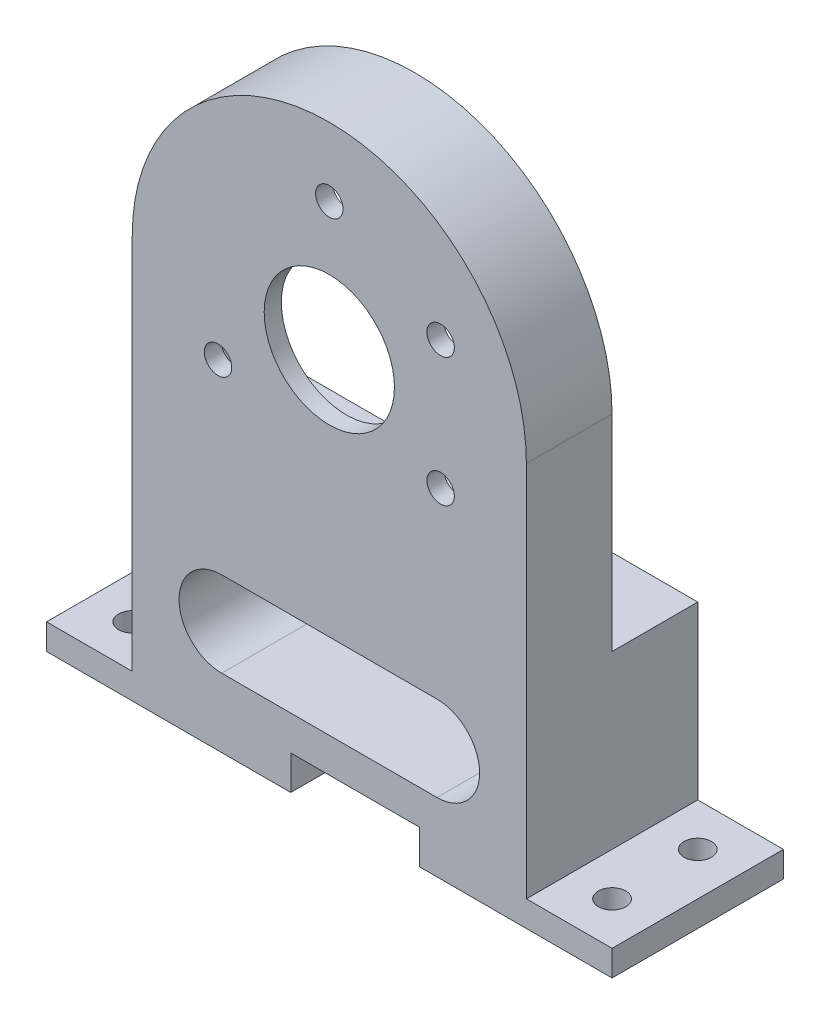
from build123d import *

# Parameters (mm, degrees)
EXTRUDE_1_DEPTH      = 20
CUT_EXTRUDE_1_DEPTH  = 10
SKETCH_3_R           = 21.1
CUT_EXTRUDE_2_DEPTH  = 8
SKETCH_7_R           = 1.6
CUT_EXTRUDE_6_DEPTH  = 3
SKETCH_8_R           = 7.6
CUT_EXTRUDE_7_DEPTH  = 3
SKETCH_12_W          = 46
SKETCH_12_H          = 20
EXTRUDE_4_DEPTH      = 20
SKETCH_14_W          = 10
SKETCH_14_H          = 20
SKETCH_14_R          = 1.6
EXTRUDE_5_DEPTH      = 3
SKETCH_16_W          = 15
SKETCH_16_H          = 20
CUT_EXTRUDE_10_DEPTH = 4
CUT_EXTRUDE_11_DEPTH = 61.811183182


with BuildPart() as part:
    # 草图1 → 凸台-拉伸1 (new body)
    with BuildSketch(Plane.XY):
        with BuildLine():
            Line((-23, 0), (-23, -27))
            Line((-23, -27), (23, -27))
            Line((23, -27), (23, 0))
            ThreePointArc((23, 0), (0, 23), (-23, 0))
        make_face()
    extrude(amount=EXTRUDE_1_DEPTH)

    # 草图2 → 切除-拉伸1 (cut)
    with BuildSketch(Plane(origin=(0, 0, 0), x_dir=(-1, 0, 0), z_dir=(0, 0, -1))):
        with BuildLine():
            Line((-23, -24), (23, -24))
            Line((23, -24), (23, 0))
            ThreePointArc((23, 0), (0, 23), (-23, 0))
            Line((-23, 0), (-23, -24))
        make_face()
    extrude(amount=-CUT_EXTRUDE_1_DEPTH, mode=Mode.SUBTRACT)

    # 草图3 → 切除-拉伸2 (cut)
    with BuildSketch(Plane(origin=(0, 0, 10), x_dir=(-1, 0, 0), z_dir=(0, 0, -1))):
        Circle(SKETCH_3_R)
    extrude(amount=-CUT_EXTRUDE_2_DEPTH, mode=Mode.SUBTRACT)

    # 草图7 → 切除-拉伸6 (cut)
    with BuildSketch(Plane.XY.offset(20)):
        with Locations((0, 15)):
            Circle(SKETCH_7_R)
        with Locations((12.990381057, 7.5)):
            Circle(SKETCH_7_R)
        with Locations((12.990381057, -7.5)):
            Circle(SKETCH_7_R)
        with Locations((-12.990381057, -7.5)):
            Circle(SKETCH_7_R)
    extrude(amount=-CUT_EXTRUDE_6_DEPTH, mode=Mode.SUBTRACT)

    # 草图8 → 切除-拉伸7 (cut)
    with BuildSketch(Plane(origin=(0, 0, 18), x_dir=(-1, 0, 0), z_dir=(0, 0, -1))):
        Circle(SKETCH_8_R)
    extrude(amount=-CUT_EXTRUDE_7_DEPTH, mode=Mode.SUBTRACT)

    # 草图12 → 凸台-拉伸4 (add)
    with BuildSketch(Plane.XZ.offset(27)):
        with Locations((0, 10)):
            Rectangle(SKETCH_12_W, SKETCH_12_H)
    extrude(amount=EXTRUDE_4_DEPTH)

    # 草图14 → 凸台-拉伸5 (add)
    # profile 1 of 2: a face of its own
    with BuildSketch(Plane.XZ.offset(47)):
        with Locations((28, 10)):
            Rectangle(SKETCH_14_W, SKETCH_14_H)
        with Locations(Location((28, 5, 0), (0, 0, 270))):
            Circle(SKETCH_14_R, mode=Mode.SUBTRACT)
        with Locations(Location((28, 15, 0), (0, 0, 270))):
            Circle(SKETCH_14_R, mode=Mode.SUBTRACT)
    # profile 2 of 2: a face of its own
    with BuildSketch(Plane.XZ.offset(47)):
        with Locations((-28, 10)):
            Rectangle(SKETCH_14_W, SKETCH_14_H)
        with Locations(Location((-28, 5, 0), (0, 0, 270))):
            Circle(SKETCH_14_R, mode=Mode.SUBTRACT)
        with Locations(Location((-28, 15, 0), (0, 0, 270))):
            Circle(SKETCH_14_R, mode=Mode.SUBTRACT)
    extrude(amount=-EXTRUDE_5_DEPTH)

    # 草图16 → 切除-拉伸10 (cut)
    with BuildSketch(Plane.XZ.offset(47)):
        with Locations((3, 10)):
            Rectangle(SKETCH_16_W, SKETCH_16_H)
    extrude(amount=-CUT_EXTRUDE_10_DEPTH, mode=Mode.SUBTRACT)

    # 草图17 → 切除-拉伸11 (cut, through all)
    with BuildSketch(Plane(origin=(0, 0, 0), x_dir=(-1, 0, 0), z_dir=(0, 0, -1))):
        with BuildLine():
            Line((-12.566151066, -29.028305096), (12.566151066, -29.028305096))
            ThreePointArc((12.566151066, -29.028305096), (17.53784597, -34), (12.566151066, -38.971694904))
            Line((12.566151066, -38.971694904), (-12.566151066, -38.971694904))
            ThreePointArc((-12.566151066, -38.971694904), (-17.53784597, -34), (-12.566151066, -29.028305096))
        make_face()
    extrude(amount=-CUT_EXTRUDE_11_DEPTH, mode=Mode.SUBTRACT)


solid = part.part
